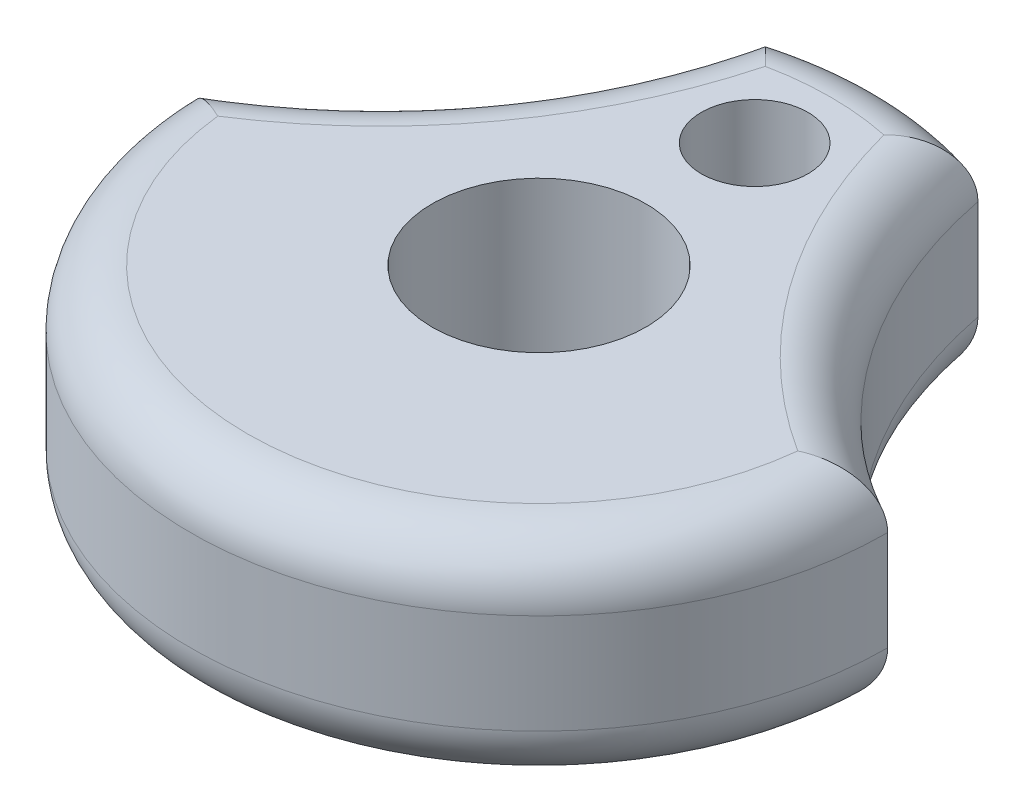
from build123d import *

# Parameters (mm, degrees)
BOSS_EXTRUDE1_DEPTH = 375
FILLET1_R           = 100
FILLET2_R           = 100


with BuildPart() as part:
    # Sketch1 → Boss-Extrude1 (new body)
    with BuildSketch(Plane(origin=(0, 0, 0), x_dir=(1, 0, 0), z_dir=(0, 1, 0))):
        with BuildLine():
            ThreePointArc((-611.4919693133057, 0), (-432.39011814255474, -432.3901181425547), (-3.744e-14, -611.4919693133057))
            Line((0, -611.4919693133057), (0, -187.5))
            ThreePointArc((-1.86631e-12, -187.5), (-132.58252147247833, -132.58252147247697), (-187.5, 2.296e-14))
            Line((-187.5, 0), (-611.4919693133057, 0))
        make_face()
        with BuildLine():
            Line((0, -187.5), (0, -611.4919693133057))
            ThreePointArc((-3.744e-14, -611.4919693133057), (432.3901181425547, -432.39011814255474), (611.4919693133057, -7.489e-14))
            Line((611.4919693133057, 0), (187.5, 0))
            ThreePointArc((187.5, -4.592e-14), (132.58252147247705, -132.58252147247828), (-1.86631e-12, -187.5))
        make_face()
        with BuildLine():
            Line((187.5, 0), (611.4919693133057, 0))
            ThreePointArc((611.4919693133056, -2.2737e-13), (335.12599508158894, 243.9066567186602), (187.9999999999999, 581.8749251640463))
            ThreePointArc((188, 581.8749251640465), (95.15929973489084, 604.0423298152456), (0, 611.4919693133056))
            Line((0, 611.4919693133057), (0, 468.44559362451025))
            ThreePointArc((2.9354e-13, 468.44559362451025), (68.16635262601869, 442.2325840672666), (96.6892055692424, 375))
            ThreePointArc((96.6892055692424, 375), (68.16635262601865, 307.76741593273334), (2.7045e-13, 281.55440637548975))
            Line((0, 281.55440637548975), (0, 187.5))
            ThreePointArc((-1.90365e-12, 187.5), (132.58252147247697, 132.58252147247833), (187.5, 0))
        make_face()
        with BuildLine():
            ThreePointArc((-188, 581.8749251640467), (-335.1259950815888, 243.90665671866032), (-611.4919693133057, 0))
            Line((-611.4919693133057, 0), (-187.5, 0))
            ThreePointArc((-187.5, 2.296e-14), (-132.5825214724783, 132.58252147247703), (-1.90365e-12, 187.5))
            Line((0, 187.5), (0, 281.55440637548975))
            ThreePointArc((2.7045e-13, 281.55440637548975), (-90.3107944307576, 375), (2.9354e-13, 468.44559362451025))
            Line((0, 468.44559362451025), (0, 611.4919693133057))
            ThreePointArc((0, 611.4919693133056), (-95.15929973489085, 604.0423298152457), (-188.00000000000003, 581.8749251640465))
        make_face()
    extrude(amount=BOSS_EXTRUDE1_DEPTH)

    # Fillet1
    fillet1_edges = [part.edges().sort_by_distance(p)[0] for p in [
        (-335.12599508158894, 375, -243.90665671866043),
        (-3.111e-14, 375, 611.4919693133057),
        (335.12599508158894, 375, -243.9066567186602),
        (-7.11e-15, 375, -611.4919693133056),
    ]]
    fillet(fillet1_edges, radius=FILLET1_R)

    # Fillet2
    fillet2_edges = [part.edges().sort_by_distance(p)[0] for p in [
        (-1.027e-14, 0, 611.4919693133057),
        (-335.12599508158894, 0, -243.90665671866043),
        (-2.132e-14, 0, -611.4919693133056),
        (335.12599508158894, 0, -243.9066567186602),
    ]]
    fillet(fillet2_edges, radius=FILLET2_R)


solid = part.part
